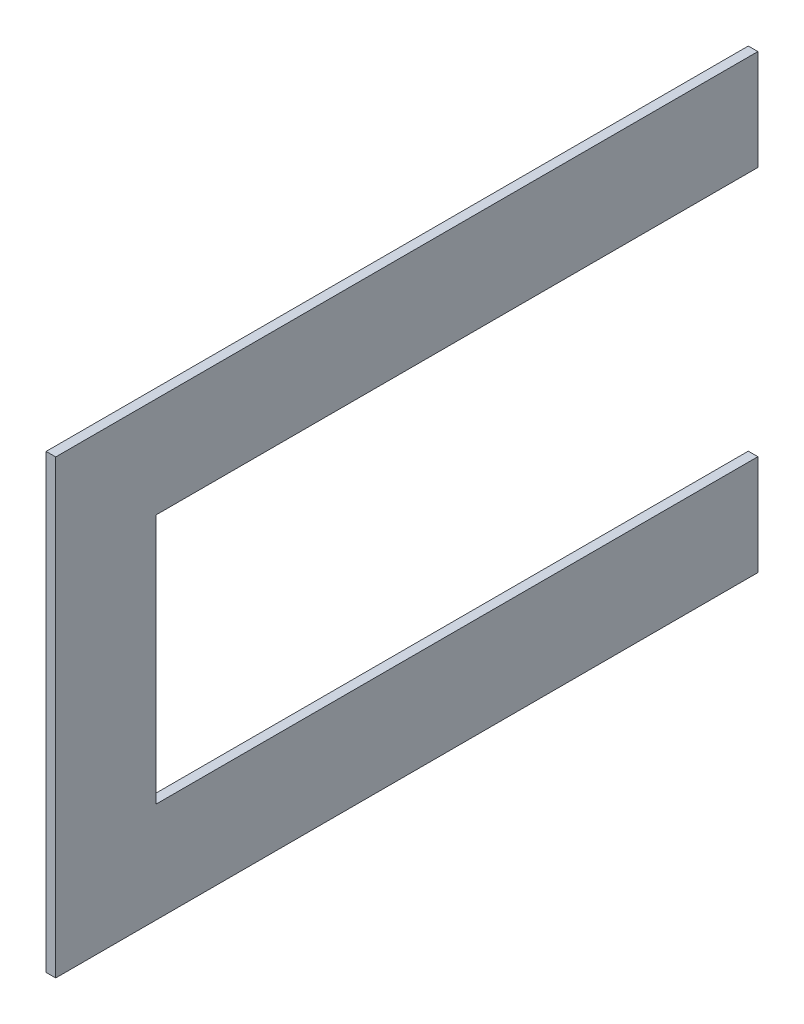
from build123d import *

# Parameters (mm, degrees)
SKETCH1_W           = 114.7953
SKETCH1_H           = 19.1516
SKETCH1_W_2         = 19.1516
BOSS_EXTRUDE1_DEPTH = 1.8288


with BuildPart() as part:
    # Sketch1 → Boss-Extrude1 (new body)
    with BuildSketch(Plane(origin=(0, 0, 0), x_dir=(0, 0, -1), z_dir=(1, 0, 0))):
        Polygon((-31.179336382, -25.30028674), (-31.179336382, 22.47711326), (-31.179336382, 41.62871326), (-50.330936382, 41.62871326), (-50.330936382, -25.30028674), align=None)
        with Locations((26.218313618, 32.05291326)):
            Rectangle(SKETCH1_W, SKETCH1_H)
        with Locations((26.218313618, -34.87608674)):
            Rectangle(SKETCH1_W, SKETCH1_H)
        with Locations((-40.755136382, -34.87608674)):
            Rectangle(SKETCH1_W_2, SKETCH1_H)
    extrude(amount=BOSS_EXTRUDE1_DEPTH)


solid = part.part
